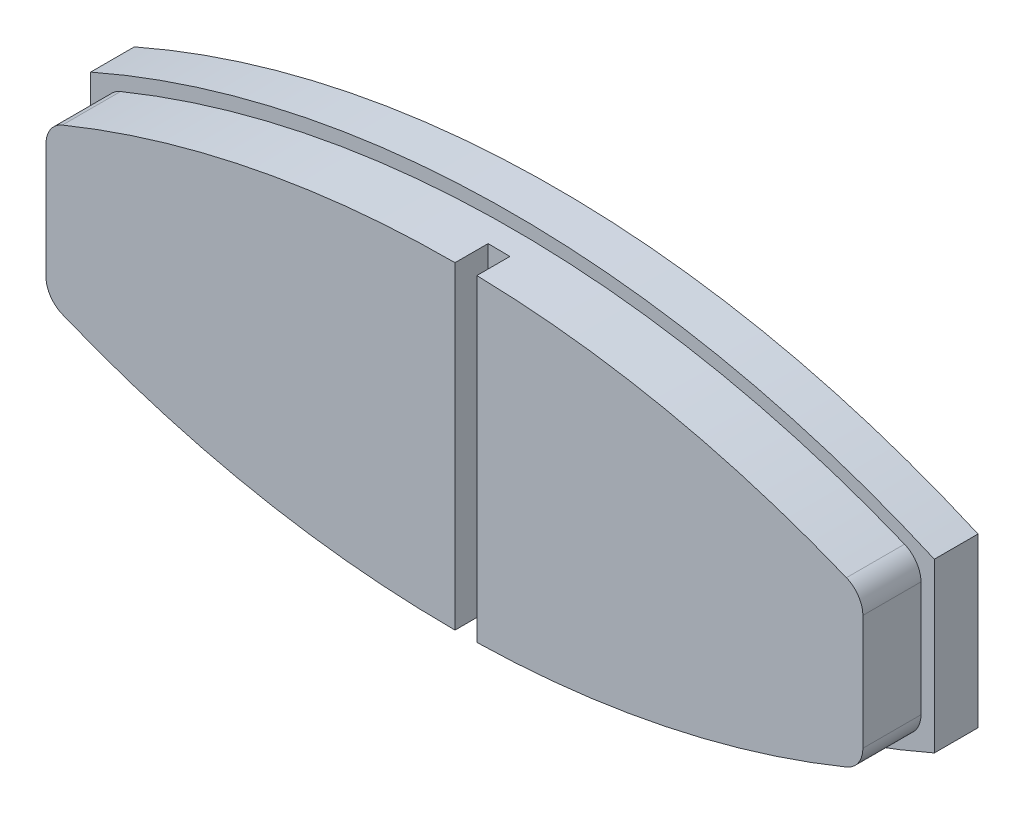
from build123d import *

# Parameters (mm, degrees)
BOSS_EXTRUDE1_DEPTH = 3.302
BOSS_EXTRUDE2_DEPTH = 4.3942
SKETCH3_R           = 3.35
CUT_EXTRUDE1_DEPTH  = 6.35
SKETCH6_W           = 1.651
SKETCH6_H           = 37.625569531
CUT_EXTRUDE2_DEPTH  = 2.5
FILLET1_R           = 2


with BuildPart() as part:
    # Sketch1 → Boss-Extrude1 (new body)
    with BuildSketch(Plane.XY):
        with BuildLine():
            Line((-31.92145, 6.35), (-31.92145, -6.35))
            ThreePointArc((-31.92145, -6.35), (0, -13.0556), (31.92145, -6.35))
            Line((31.92145, -6.35), (31.92145, 6.35))
            ThreePointArc((31.92145, 6.35), (0, 13.0556), (-31.92145, 6.35))
        make_face()
    extrude(amount=BOSS_EXTRUDE1_DEPTH)

    # Sketch3 → Cut-Extrude1 (cut)
    with BuildSketch(Plane(origin=(0, 0, 0), x_dir=(-1, 0, 0), z_dir=(0, 0, -1))):
        with Locations((-23.8125, 0)):
            Circle(SKETCH3_R)
        with Locations(Location((23.8125, 0, 0), (0, 0, 180))):
            Circle(SKETCH3_R)
    extrude(amount=-CUT_EXTRUDE1_DEPTH, mode=Mode.SUBTRACT)


with BuildPart() as body_2:
    # Sketch2 → Boss-Extrude2 (new body)
    with BuildSketch(Plane.XY.offset(3.302)):
        with BuildLine():
            Line((-30.90545, 5.683695808), (-30.90545, -5.683695808))
            ThreePointArc((-30.90545, -5.683695808), (0, -12.0396), (30.90545, -5.683695808))
            Line((30.90545, -5.683695808), (30.90545, 5.683695808))
            ThreePointArc((30.90545, 5.683695808), (0, 12.0396), (-30.90545, 5.683695808))
        make_face()
    extrude(amount=BOSS_EXTRUDE2_DEPTH)

    # Sketch6 → Cut-Extrude2 (cut)
    with BuildSketch(Plane.XY.offset(7.6962)):
        with Locations((0.86995, -0.296005355)):
            Rectangle(SKETCH6_W, SKETCH6_H)
    extrude(amount=-CUT_EXTRUDE2_DEPTH, mode=Mode.SUBTRACT)

    # Fillet1
    fillet1_edges = [body_2.edges().sort_by_distance(p)[0] for p in [
        (30.90545, 5.683695808, 5.4991),
        (30.90545, -5.683695808, 5.4991),
        (-30.90545, -5.683695808, 5.4991),
        (-30.90545, 5.683695808, 5.4991),
    ]]
    fillet(fillet1_edges, radius=FILLET1_R)


solid = Compound([part.part, body_2.part])
